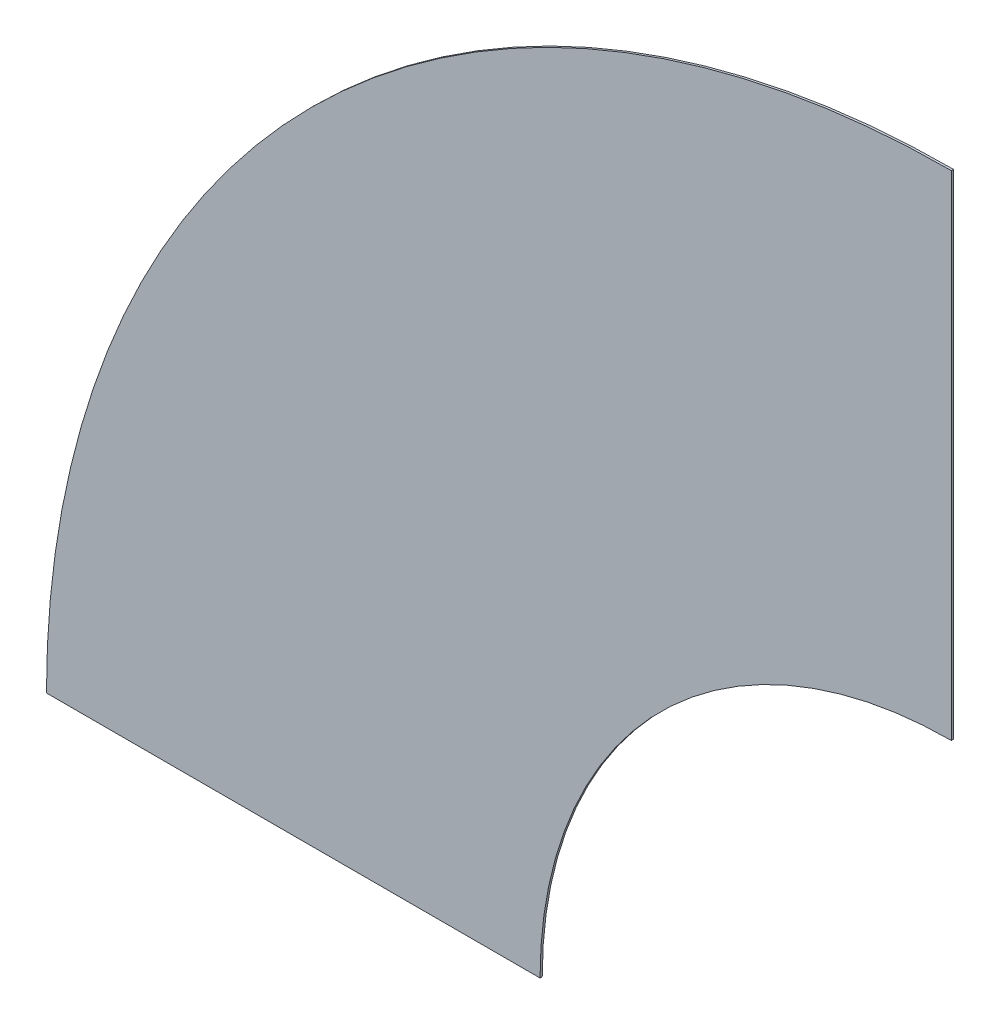
from build123d import *

# Parameters (mm, degrees)
SKETCH_3_W = 2
SKETCH_3_H = 450


with BuildPart() as part:
    # 扫描1: sweep along a path in 草图1
    with BuildLine(Plane.XY) as sweep_1_path:
        ThreePointArc((0, 600), (-424.264068712, 424.264068712), (-600, 0))
    # 草图3 → 扫描1 (sweep)
    with BuildSketch(Plane(origin=(0, 600, 0), x_dir=(0, 0, 1), z_dir=(-1, 0, 0))):
        Rectangle(SKETCH_3_W, SKETCH_3_H)
    sweep(path=sweep_1_path.line)


solid = part.part
